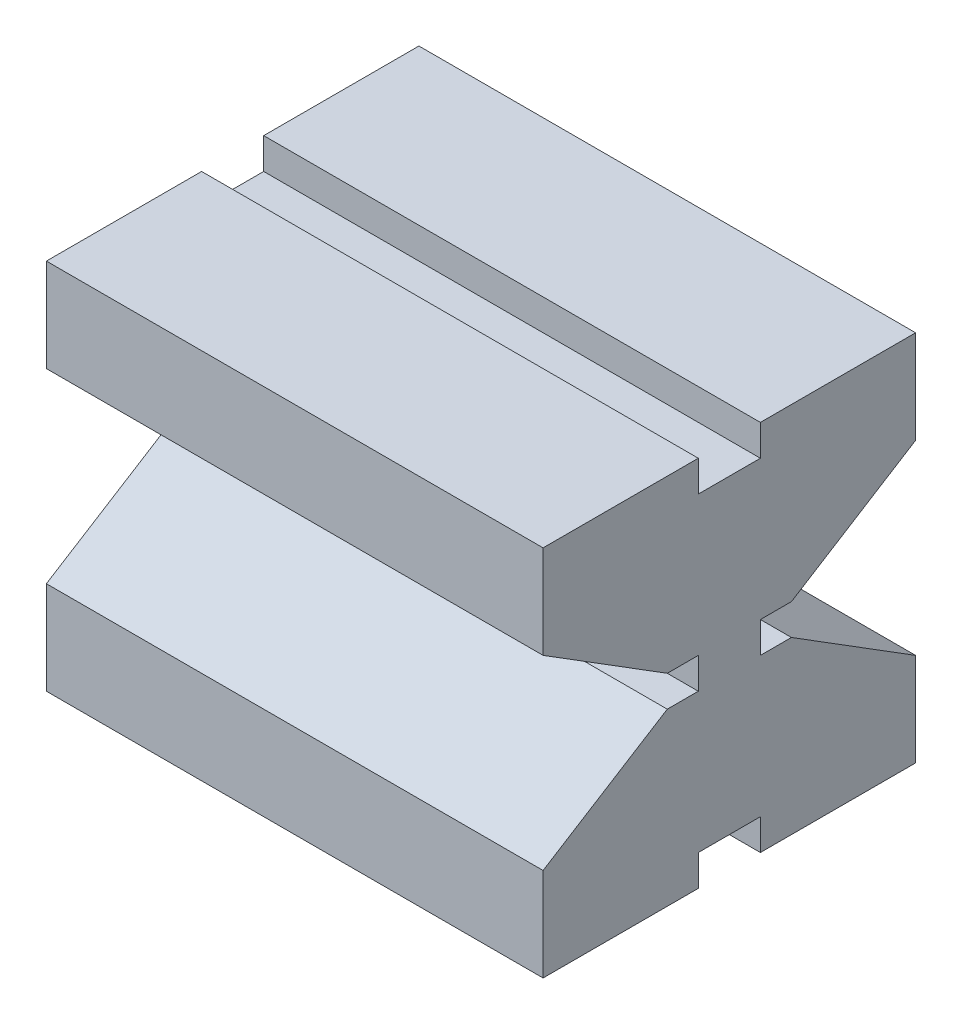
from build123d import *

# Parameters (mm, degrees)
BOSS_EXTRUDE1_DEPTH = 40


with BuildPart() as part:
    # Sketch1 → Boss-Extrude1 (new, symmetric)
    with BuildSketch(Plane.YZ):
        Polygon((-30, 30), (-15, 30), (-2.5, 10), (-2.5, 5), (2.5, 5), (2.5, 10), (15, 30), (30, 30), (30, 5), (25, 5), (25, -5), (30, -5), (30, -30), (15, -30), (2.5, -10), (2.5, -5), (-2.5, -5), (-2.5, -10), (-15, -30), (-30, -30), (-30, -5), (-25, -5), (-25, 5), (-30, 5), align=None)
    extrude(amount=BOSS_EXTRUDE1_DEPTH, both=True)


solid = part.part
